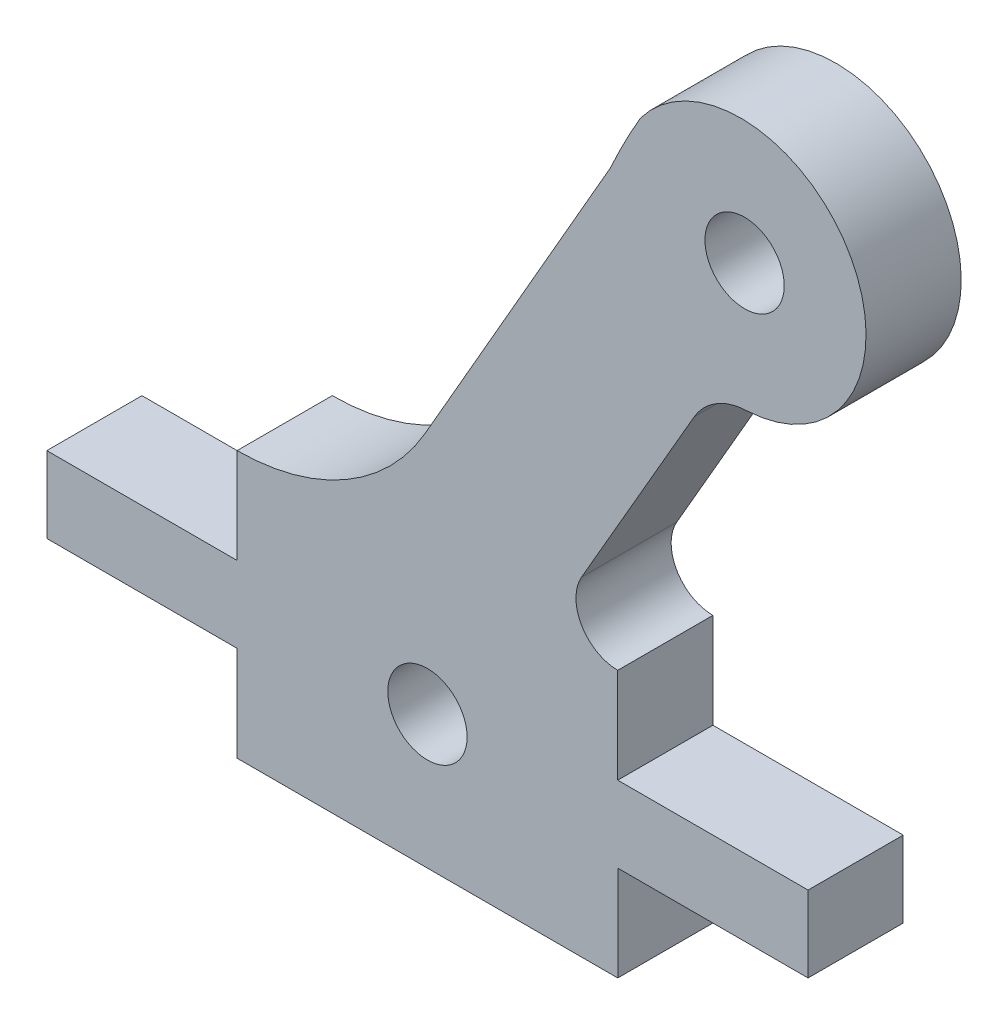
from build123d import *

# Parameters (mm, degrees)
SKETCH_1_R      = 1.25
EXTRUDE_1_DEPTH = 3


with BuildPart() as part:
    # 草圖1 → 填料-伸長1 (new body)
    with BuildSketch(Plane.XY):
        with BuildLine():
            Line((176.997829455, 94.090647642), (182.997829455, 94.090647642))
            Line((182.997829455, 94.090647642), (182.997829455, 91.090647642))
            Line((182.997829455, 91.090647642), (194.997829455, 91.090647642))
            Line((194.997829455, 91.090647642), (194.997829455, 94.090647642))
            Line((194.997829455, 94.090647642), (200.997480004, 94.090647642))
            Line((200.997480004, 94.090647642), (200.997352724, 96.492024196))
            Line((200.997352724, 96.492024196), (194.997268864, 96.491529213))
            Line((194.997268864, 96.491529213), (194.997092083, 99.491571149))
            ThreePointArc((194.997092083, 99.491571149), (193.856810942, 100.149752496), (193.856719482, 101.466355608))
            Line((193.856719482, 101.466355608), (197.405251993, 107.613881172))
            ThreePointArc((197.405251993, 107.613881172), (198.117024198, 108.334127459), (199.090346419, 108.613444913))
            ThreePointArc((199.090346419, 108.613444913), (202.359526716, 114.420412435), (195.715093084, 114.930229379))
            ThreePointArc((195.715093084, 114.930229379), (195.216102323, 114.022712023), (194.764370405, 113.090768996))
            Line((194.764370405, 113.090768996), (188.915903997, 102.908445849))
            ThreePointArc((188.915903997, 102.908445849), (186.414409015, 100.406509969), (182.997065783, 99.490581194))
            Line((182.997065783, 99.490581194), (182.997383985, 96.490539269))
            Line((182.997383985, 96.490539269), (176.997300124, 96.490044286))
            Line((176.997300124, 96.490044286), (176.997829455, 94.090647642))
        make_face()
        with Locations((188.997425419, 95.291074035)):
            Circle(SKETCH_1_R, mode=Mode.SUBTRACT)
        with Locations((198.996042035, 112.612338124)):
            Circle(SKETCH_1_R, mode=Mode.SUBTRACT)
    extrude(amount=EXTRUDE_1_DEPTH)


solid = part.part
